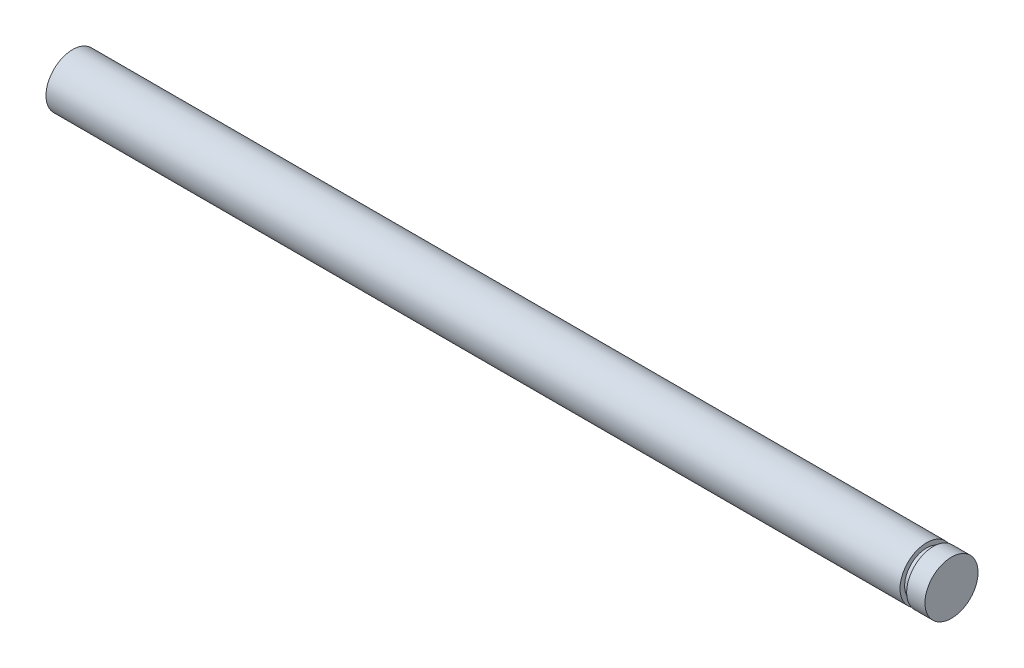
from build123d import *


with BuildPart() as part:
    # Sketch1 → Revolve1 (revolve)
    with BuildSketch(Plane.XY, mode=Mode.PRIVATE) as revolve1_sk:
        Polygon((0, 0), (609.6, 0), (609.6, -18.415), (596.9, -18.415), (596.9, -15.24), (592.328, -15.24), (592.328, -18.415), (0, -18.415), align=None)
    revolve(revolve1_sk.sketch.rotate(Axis((0, 0, 0), (1, 0, 0)), 270), axis=Axis((0, 0, 0), (1, 0, 0)))


solid = part.part
